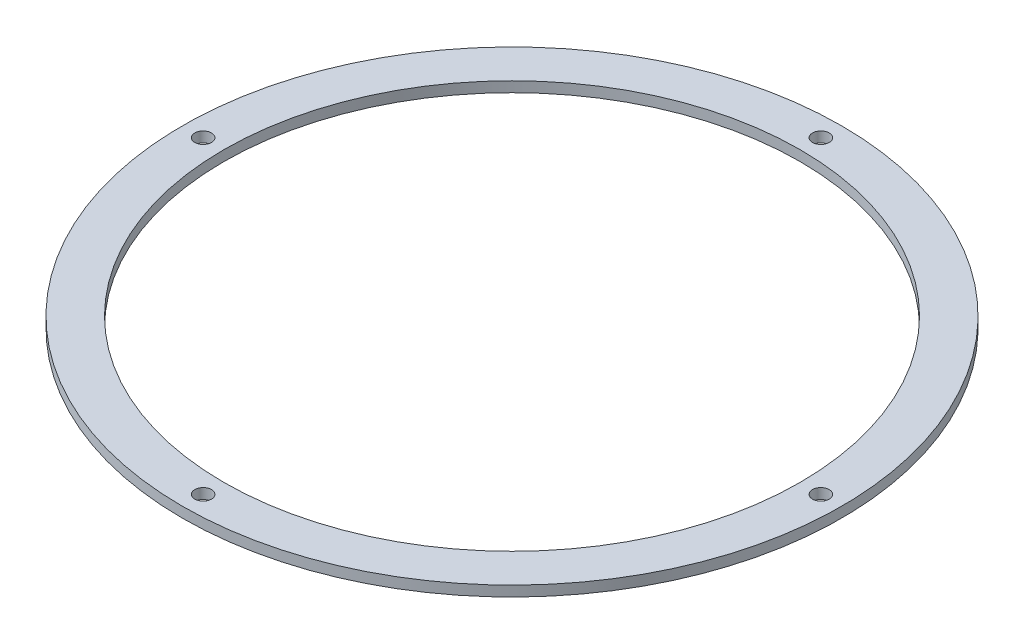
from build123d import *

# Parameters (mm, degrees)
SKETCH2_R           = 101.099999984
SKETCH2_R_2         = 88.399999984
SKETCH2_R_3         = 2.5527
BOSS_EXTRUDE1_DEPTH = 3.175


with BuildPart() as part:
    # Sketch2 → Boss-Extrude1 (new body)
    with BuildSketch(Plane(origin=(0, 0, 0), x_dir=(1, 0, 0), z_dir=(0, 1, 0))):
        with Locations(Location((0, 0, 0), (0, 0, 270))):
            Circle(SKETCH2_R)
        with Locations(Location((0, 0, 0), (0, 0, 270))):
            Circle(SKETCH2_R_2, mode=Mode.SUBTRACT)
        with Locations(Location((0, -94.749999984, 0), (0, 0, 270))):
            Circle(SKETCH2_R_3, mode=Mode.SUBTRACT)
        with Locations(Location((-94.749999984, 0, 0), (0, 0, 270))):
            Circle(SKETCH2_R_3, mode=Mode.SUBTRACT)
        with Locations(Location((0, 94.749999984, 0), (0, 0, 270))):
            Circle(SKETCH2_R_3, mode=Mode.SUBTRACT)
        with Locations(Location((94.749999984, 0, 0), (0, 0, 270))):
            Circle(SKETCH2_R_3, mode=Mode.SUBTRACT)
    extrude(amount=BOSS_EXTRUDE1_DEPTH)


solid = part.part
